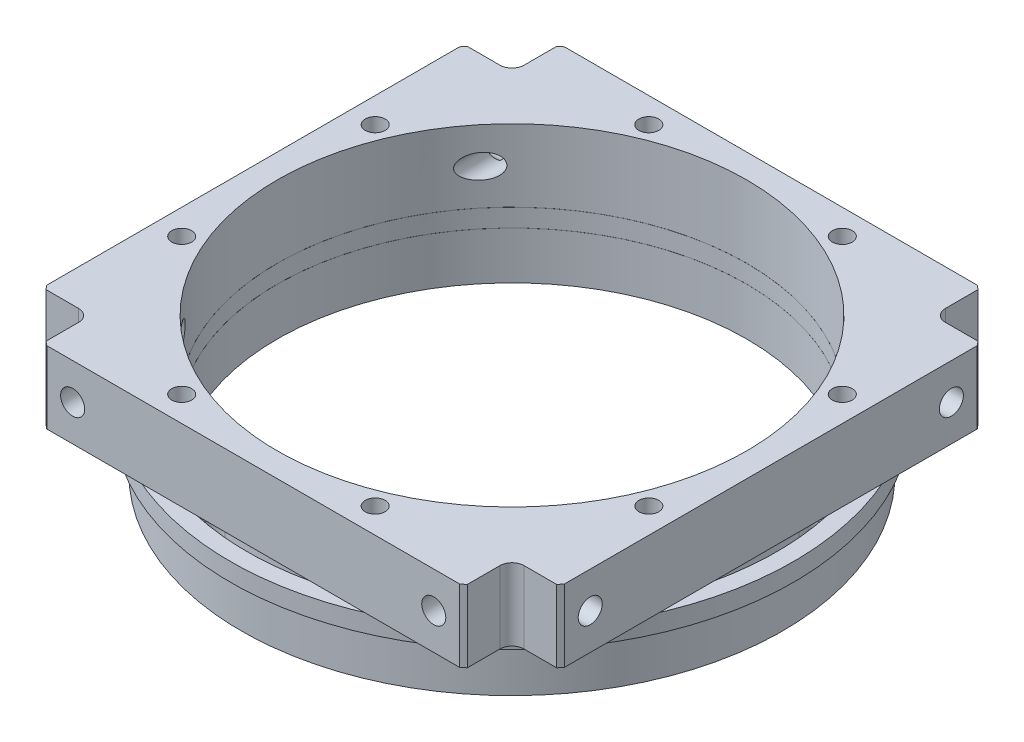
from build123d import *

# Parameters (mm, degrees)
SKETCH_2_OUTSIDE_W          = 143.448
SKETCH_2_OUTSIDE_H          = 143.448
SKETCH_2_OUTSIDE_W_2        = 86
SKETCH_2_OUTSIDE_H_2        = 86
CUT_EXTRUDE_1_DEPTH         = 12
SKETCH_4_R                  = 2
CUT_EXTRUDE_3_DEPTH         = 104.820470043
SKETCH_5_R                  = 2
CUT_EXTRUDE_4_DEPTH         = 12
CUT_EXTRUDE_START           = -74
SKETCH_5_2_R                = 2
CUT_EXTRUDE_5_DEPTH         = 12
SKETCH_6_R                  = 1.65
CUT_EXTRUDE_6_DEPTH         = 100
SKETCH_10_R                 = 2.1
CUT_EXTRUDE_8_DEPTH         = 10.9
PATTERN_CIRCULAR_1_COUNT    = 8
CUT_EXTRUDE_7_DEPTH         = 20
CUT_EXTRUDE_3319_DEPTH      = 71.034919894
CUT_EXTRUDE_3319_DEPTH_BACK = 71.034919894
SKETCH_11_W                 = 136.197392648
SKETCH_11_H                 = 0.01
CUT_EXTRUDE_9_DEPTH         = 71.034919894


with BuildPart() as part:
    # 草图1 → 旋转1 (revolve)
    with BuildSketch(Plane.XY, mode=Mode.PRIVATE) as revolve_1_sk:
        Polygon((-39, 0), (-45, 0), (-45, 7.9), (-46.8, 7.9), (-46.8, 10.9), (-55, 10.9), (-55, 22.9), (-39, 22.9), align=None)
    revolve(revolve_1_sk.sketch.rotate(Axis((0, 0, 0), (0, 1, 0)), 270), axis=Axis((0, 0, 0), (0, 1, 0)))

    # 草图2 outside → 切除-拉伸1 (cut)
    with BuildSketch(Plane(origin=(0, 22.9, 0), x_dir=(1, 0, 0), z_dir=(0, 1, 0))):
        Rectangle(SKETCH_2_OUTSIDE_W, SKETCH_2_OUTSIDE_H)
        Rectangle(SKETCH_2_OUTSIDE_W_2, SKETCH_2_OUTSIDE_H_2, mode=Mode.SUBTRACT)
    extrude(amount=-CUT_EXTRUDE_1_DEPTH, mode=Mode.SUBTRACT)

    # 草图4 → 切除-拉伸3 (cut, through all)
    with BuildSketch(Plane.XY.offset(43)):
        with Locations((-30, 16.9)):
            Circle(SKETCH_4_R)
        with Locations((30, 16.9)):
            Circle(SKETCH_4_R)
    extrude(amount=-CUT_EXTRUDE_3_DEPTH, mode=Mode.SUBTRACT)

    # 草图5 → 切除-拉伸4 (cut)
    with BuildSketch(Plane.ZY.offset(43)):
        with Locations((-30, 16.9)):
            Circle(SKETCH_5_R)
        with Locations((30, 16.9)):
            Circle(SKETCH_5_R)
    extrude(amount=-CUT_EXTRUDE_4_DEPTH, mode=Mode.SUBTRACT)

    # 草图5<2> → 切除-拉伸5 (cut)
    with BuildSketch(Plane.ZY.offset(43).offset(CUT_EXTRUDE_START)):
        with Locations((-30, 16.9)):
            Circle(SKETCH_5_2_R)
        with Locations((30, 16.9)):
            Circle(SKETCH_5_2_R)
    extrude(amount=-CUT_EXTRUDE_5_DEPTH, mode=Mode.SUBTRACT)

    # 草图6 → 切除-拉伸6 (cut)
    with BuildSketch(Plane.XZ):
        with Locations(Location((-16.072704159, -38.802940365, 0), (0, 0, 270))):
            Circle(SKETCH_6_R)
    cut_extrude_6 = extrude(amount=-CUT_EXTRUDE_6_DEPTH, mode=Mode.SUBTRACT)

    # 草图10 → 切除-拉伸8 (cut)
    with BuildSketch(Plane.XZ):
        with Locations(Location((-16.072704159, -38.802940365, 0), (0, 0, 270))):
            Circle(SKETCH_10_R)
    cut_extrude_8 = extrude(amount=-CUT_EXTRUDE_8_DEPTH, mode=Mode.SUBTRACT)

    # 阵列(圆周)1: 切除-拉伸6, 切除-拉伸8 ×8 about axis
    pattern_circular_1_axis = Axis((0, 0, 0), (0, 1, 0))
    add([cut_extrude_6.rotate(pattern_circular_1_axis, i * 360 / PATTERN_CIRCULAR_1_COUNT) for i in range(1, PATTERN_CIRCULAR_1_COUNT)], mode=Mode.SUBTRACT)
    add([cut_extrude_8.rotate(pattern_circular_1_axis, i * 360 / PATTERN_CIRCULAR_1_COUNT) for i in range(1, PATTERN_CIRCULAR_1_COUNT)], mode=Mode.SUBTRACT)

    # 草图7 → 切除-拉伸7 (cut)
    with BuildSketch(Plane(origin=(0, 22.9, 0), x_dir=(1, 0, 0), z_dir=(0, 1, 0))):
        with BuildLine():
            Line((-37, 35), (-53, 35))
            ThreePointArc((-53, 35), (-54.414213562, 35.585786438), (-55, 37))
            Line((-55, 37), (-55, 53))
            ThreePointArc((-55, 53), (-54.414213562, 54.414213562), (-53, 55))
            Line((-53, 55), (-37, 55))
            ThreePointArc((-37, 55), (-35.585786438, 54.414213562), (-35, 53))
            Line((-35, 53), (-35, 37))
            ThreePointArc((-35, 37), (-35.585786438, 35.585786438), (-37, 35))
        make_face()
        with BuildLine():
            Line((37, 35), (53, 35))
            ThreePointArc((53, 35), (54.414213562, 35.585786438), (55, 37))
            Line((55, 37), (55, 53))
            ThreePointArc((55, 53), (54.414213562, 54.414213562), (53, 55))
            Line((53, 55), (37, 55))
            ThreePointArc((37, 55), (35.585786438, 54.414213562), (35, 53))
            Line((35, 53), (35, 37))
            ThreePointArc((35, 37), (35.585786438, 35.585786438), (37, 35))
        make_face()
        with BuildLine():
            Line((37, -35), (53, -35))
            ThreePointArc((53, -35), (54.414213562, -35.585786438), (55, -37))
            Line((55, -37), (55, -53))
            ThreePointArc((55, -53), (54.414213562, -54.414213562), (53, -55))
            Line((53, -55), (37, -55))
            ThreePointArc((37, -55), (35.585786438, -54.414213562), (35, -53))
            Line((35, -53), (35, -37))
            ThreePointArc((35, -37), (35.585786438, -35.585786438), (37, -35))
        make_face()
        with BuildLine():
            Line((-37, -35), (-53, -35))
            ThreePointArc((-53, -35), (-54.414213562, -35.585786438), (-55, -37))
            Line((-55, -37), (-55, -53))
            ThreePointArc((-55, -53), (-54.414213562, -54.414213562), (-53, -55))
            Line((-53, -55), (-37, -55))
            ThreePointArc((-37, -55), (-35.585786438, -54.414213562), (-35, -53))
            Line((-35, -53), (-35, -37))
            ThreePointArc((-35, -37), (-35.585786438, -35.585786438), (-37, -35))
        make_face()
    extrude(amount=-CUT_EXTRUDE_7_DEPTH, mode=Mode.SUBTRACT)

    # 草图11 → Cut-Extrude 3319 (cut, two sides: drawn at the far end of the back side and taken through both)
    with BuildSketch(Plane(origin=(0, 0, 0), x_dir=(0, 0, -1), z_dir=(1, 0, 0)).offset(-CUT_EXTRUDE_3319_DEPTH_BACK)):
        with Locations((-5.996836933, 7.895)):
            Rectangle(SKETCH_11_W, SKETCH_11_H)
        with Locations((-5.996836933, 10.895)):
            Rectangle(SKETCH_11_W, SKETCH_11_H)
    extrude(amount=CUT_EXTRUDE_3319_DEPTH + CUT_EXTRUDE_3319_DEPTH_BACK, mode=Mode.SUBTRACT)


with BuildPart() as cut_extrude_3319_piece_1:
    # of the separate pieces the step leaves, piece 1, a body of its own (cut_extrude_3319_pieces)
    add(part.part.solids().sort_by_distance((40.452940365, 10.9, -16.072704159))[0])


with BuildPart() as cut_extrude_3319_piece_2:
    # of the separate pieces the step leaves, piece 2, a body of its own (cut_extrude_3319_pieces)
    add(part.part.solids().sort_by_distance((0, 0, -45))[0])


with BuildPart() as cut_extrude_3319_piece_3:
    # of the separate pieces the step leaves, piece 3, a body of its own (cut_extrude_3319_pieces)
    add(part.part.solids().sort_by_distance((0, 7.9, -46.8))[0])


with BuildPart() as cut_extrude_9_tool:
    # 草图12 → 切除-拉伸9 (new, through all)
    with BuildSketch(Plane.XZ):
        with BuildLine():
            ThreePointArc((9.523343013, 42.957024313), (0, 44), (-9.523343013, 42.957024313))
            ThreePointArc((-9.523343013, 42.957024313), (-11.0430558, 40.571553071), (-8.657584558, 39.051840285))
            ThreePointArc((-8.657584558, 39.051840285), (0, 40), (8.657584558, 39.051840285))
            ThreePointArc((8.657584558, 39.051840285), (11.0430558, 40.571553071), (9.523343013, 42.957024313))
        make_face()
        with BuildLine():
            ThreePointArc((37.109223616, 23.641182767), (31.112698372, 31.112698372), (23.641182767, 37.109223616))
            ThreePointArc((23.641182767, 37.109223616), (20.879800659, 36.497039941), (21.491984334, 33.735657833))
            ThreePointArc((21.491984334, 33.735657833), (28.284271247, 28.284271247), (33.735657833, 21.491984334))
            ThreePointArc((33.735657833, 21.491984334), (36.497039941, 20.879800659), (37.109223616, 23.641182767))
        make_face()
        with BuildLine():
            ThreePointArc((42.957024313, -9.523343013), (44, 0), (42.957024313, 9.523343013))
            ThreePointArc((42.957024313, 9.523343013), (40.571553071, 11.0430558), (39.051840285, 8.657584558))
            ThreePointArc((39.051840285, 8.657584558), (40, 0), (39.051840285, -8.657584558))
            ThreePointArc((39.051840285, -8.657584558), (40.571553071, -11.0430558), (42.957024313, -9.523343013))
        make_face()
        with BuildLine():
            ThreePointArc((23.641182767, -37.109223616), (31.112698372, -31.112698372), (37.109223616, -23.641182767))
            ThreePointArc((37.109223616, -23.641182767), (36.497039941, -20.879800659), (33.735657833, -21.491984334))
            ThreePointArc((33.735657833, -21.491984334), (28.284271247, -28.284271247), (21.491984334, -33.735657833))
            ThreePointArc((21.491984334, -33.735657833), (20.879800659, -36.497039941), (23.641182767, -37.109223616))
        make_face()
        with BuildLine():
            ThreePointArc((-9.523343013, -42.957024313), (0, -44), (9.523343013, -42.957024313))
            ThreePointArc((9.523343013, -42.957024313), (11.0430558, -40.571553071), (8.657584558, -39.051840285))
            ThreePointArc((8.657584558, -39.051840285), (0, -40), (-8.657584558, -39.051840285))
            ThreePointArc((-8.657584558, -39.051840285), (-11.0430558, -40.571553071), (-9.523343013, -42.957024313))
        make_face()
        with BuildLine():
            ThreePointArc((-37.109223616, -23.641182767), (-31.112698372, -31.112698372), (-23.641182767, -37.109223616))
            ThreePointArc((-23.641182767, -37.109223616), (-20.879800659, -36.497039941), (-21.491984334, -33.735657833))
            ThreePointArc((-21.491984334, -33.735657833), (-28.284271247, -28.284271247), (-33.735657833, -21.491984334))
            ThreePointArc((-33.735657833, -21.491984334), (-36.497039941, -20.879800659), (-37.109223616, -23.641182767))
        make_face()
        with BuildLine():
            ThreePointArc((-42.957024313, 9.523343013), (-44, 0), (-42.957024313, -9.523343013))
            ThreePointArc((-42.957024313, -9.523343013), (-40.571553071, -11.0430558), (-39.051840285, -8.657584558))
            ThreePointArc((-39.051840285, -8.657584558), (-40, 0), (-39.051840285, 8.657584558))
            ThreePointArc((-39.051840285, 8.657584558), (-40.571553071, 11.0430558), (-42.957024313, 9.523343013))
        make_face()
        with BuildLine():
            ThreePointArc((-23.641182767, 37.109223616), (-31.112698372, 31.112698372), (-37.109223616, 23.641182767))
            ThreePointArc((-37.109223616, 23.641182767), (-36.497039941, 20.879800659), (-33.735657833, 21.491984334))
            ThreePointArc((-33.735657833, 21.491984334), (-28.284271247, 28.284271247), (-21.491984334, 33.735657833))
            ThreePointArc((-21.491984334, 33.735657833), (-20.879800659, 36.497039941), (-23.641182767, 37.109223616))
        make_face()
    extrude(amount=-CUT_EXTRUDE_9_DEPTH)


with BuildPart() as cut_extrude_3319_piece_2_1:
    add(cut_extrude_3319_piece_2.part)

    # 切除-拉伸9: cut by cut_extrude_9_tool
    add(cut_extrude_9_tool.part, mode=Mode.SUBTRACT)


with BuildPart() as cut_extrude_3319_piece_3_1:
    add(cut_extrude_3319_piece_3.part)

    # 切除-拉伸9: cut by cut_extrude_9_tool
    add(cut_extrude_9_tool.part, mode=Mode.SUBTRACT)


solid = Compound([cut_extrude_3319_piece_1.part, cut_extrude_3319_piece_2_1.part, cut_extrude_3319_piece_3_1.part])
